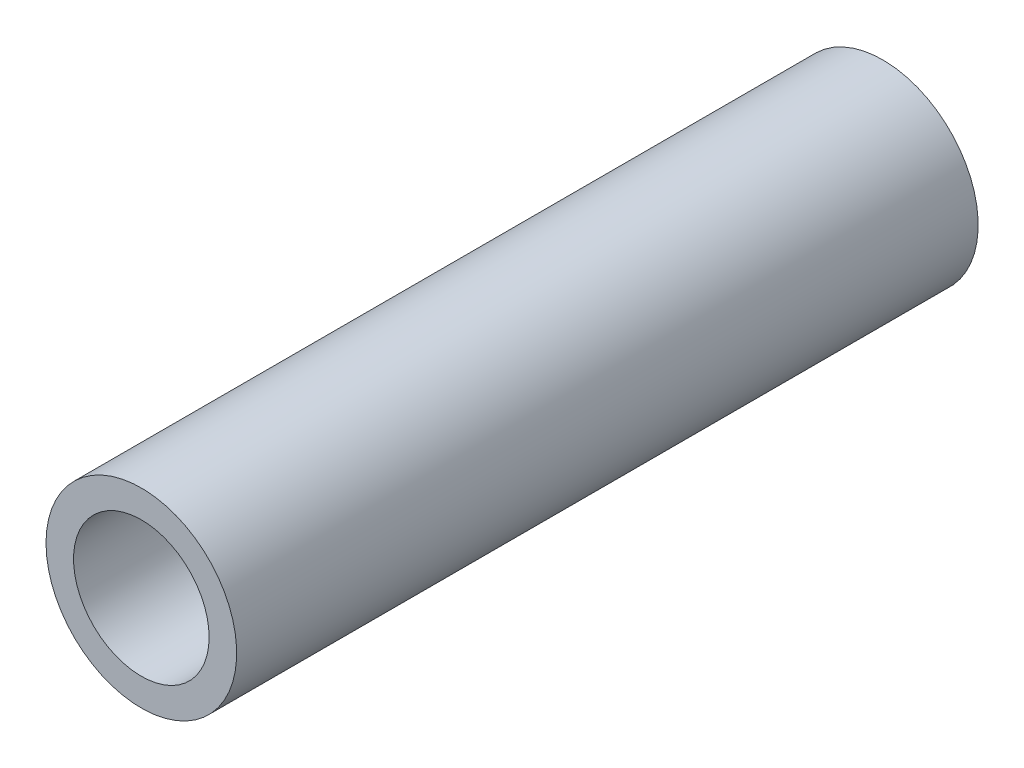
from build123d import *

# Parameters (mm, degrees)
SKETCH2_R           = 5.715
BOSS_EXTRUDE1_DEPTH = 19.05
CUT_EXTRUDE1_DEPTH  = 21.693596836
SKETCH9_R           = 5.715
BOSS_EXTRUDE5_DEPTH = 12.7
SKETCH10_R          = 5.715
BOSS_EXTRUDE6_DEPTH = 12.7
SKETCH11_R          = 4.064
CUT_EXTRUDE2_DEPTH  = 19.05


with BuildPart() as part:
    # Sketch2 → Boss-Extrude1 (new body)
    with BuildSketch(Plane.XY):
        with Locations(Location((0, 0, 0), (0, 0, 180))):
            Circle(SKETCH2_R)
    extrude(amount=BOSS_EXTRUDE1_DEPTH)

    # Sketch3 → Cut-Extrude1 (cut, through all)
    with BuildSketch(Plane(origin=(0, 0, 0), x_dir=(-1, 0, 0), z_dir=(0, 0, -1))):
        with BuildLine():
            Line((-1.710685757, 2.4765), (1.710685757, 2.4765))
            ThreePointArc((1.710685757, 2.4765), (0, -3.0099), (-1.710685757, 2.4765))
        make_face()
    extrude(amount=-CUT_EXTRUDE1_DEPTH, mode=Mode.SUBTRACT)

    # Sketch9 → Boss-Extrude5 (add)
    with BuildSketch(Plane.XY.offset(19.05)):
        with Locations(Location((0, 0, 0), (0, 0, 180))):
            Circle(SKETCH9_R)
    extrude(amount=BOSS_EXTRUDE5_DEPTH)

    # Sketch10 → Boss-Extrude6 (add)
    with BuildSketch(Plane.XY.offset(31.75)):
        with Locations(Location((0, 0, 0), (0, 0, 180))):
            Circle(SKETCH10_R)
    extrude(amount=BOSS_EXTRUDE6_DEPTH)

    # Sketch11 → Cut-Extrude2 (cut)
    with BuildSketch(Plane.XY.offset(44.45)):
        Circle(SKETCH11_R)
    extrude(amount=-CUT_EXTRUDE2_DEPTH, mode=Mode.SUBTRACT)


solid = part.part
